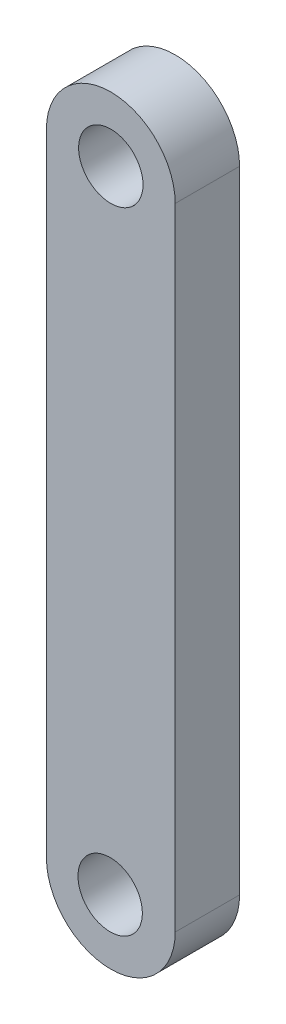
from build123d import *

# Parameters (mm, degrees)
SKETCH1_R           = 1
BOSS_EXTRUDE1_DEPTH = 2


with BuildPart() as part:
    # Sketch1 → Boss-Extrude1 (new body)
    with BuildSketch(Plane.XY):
        with BuildLine():
            Line((-2, 0), (-2, 19.6))
            ThreePointArc((-2, 19.6), (0, 21.6), (2, 19.6))
            Line((2, 19.6), (2, 0))
            ThreePointArc((2, 0), (0, -2), (-2, 0))
        make_face()
        with Locations((0, 19.6)):
            Circle(SKETCH1_R, mode=Mode.SUBTRACT)
        with Locations((-0.01951701, -0.003830514)):
            Circle(SKETCH1_R, mode=Mode.SUBTRACT)
    extrude(amount=BOSS_EXTRUDE1_DEPTH)


solid = part.part
